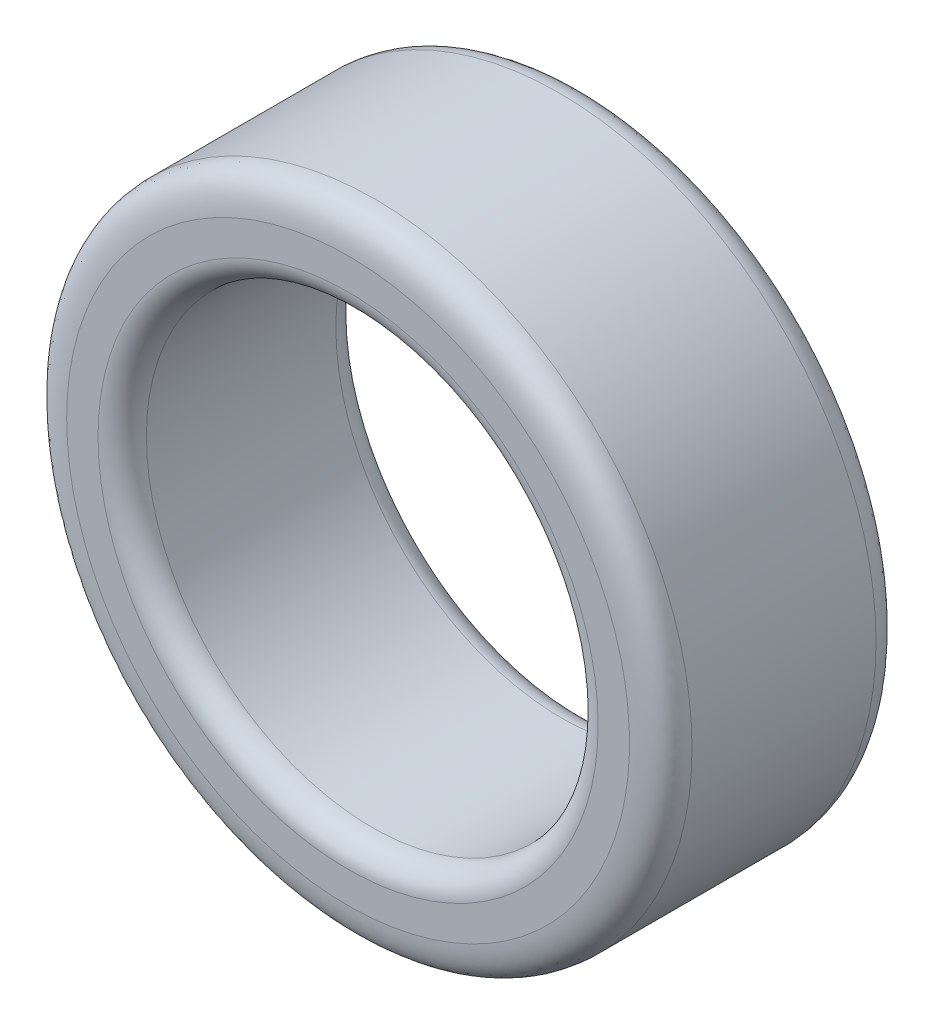
from build123d import *

# Parameters (mm, degrees)
ESQUISSE1_R        = 80
ESQUISSE1_R_2      = 57
BOSS_EXTRU_1_DEPTH = 46.43


with BuildPart() as part:
    # Esquisse1 → Boss.-Extru.1 (new body)
    with BuildSketch(Plane.XY):
        Circle(ESQUISSE1_R)
        Circle(ESQUISSE1_R_2, mode=Mode.SUBTRACT)
    extrude(amount=BOSS_EXTRU_1_DEPTH)

    # Esquisse2 → Révolution1 (revolve)
    with BuildSketch(Plane(origin=(0, 0, 0), x_dir=(0, 0, -1), z_dir=(1, 0, 0)), mode=Mode.PRIVATE) as r_volution1_sk:
        with BuildLine():
            Line((0, 57), (0.689038023, 57))
            ThreePointArc((0.689038023, 57), (5.003069609, 58.786930391), (6.79, 63.100961977))
            Line((6.79, 63.100961977), (6.79, 64))
            Line((6.79, 64), (6.79, 71.015274994))
            add(Edge.make_bspline(
                [(6.79, 71.015274994), (6.446653278, 77.904299494), (4.024026126, 79.849265176), (0, 80)],
                knots=[0, 0, 0, 0, 1, 1, 1, 1], degree=3))
            Line((0, 80), (0, 57))
        make_face()
        with BuildLine():
            Line((-46.43, 57), (-47.119038023, 57))
            ThreePointArc((-47.119038023, 57), (-51.433069609, 58.786930391), (-53.22, 63.100961977))
            Line((-53.22, 63.100961977), (-53.22, 64))
            Line((-53.22, 64), (-53.22, 71.015274994))
            add(Edge.make_bspline(
                [(-53.22, 71.015274994), (-52.876653278, 77.904299494), (-50.454026126, 79.849265176), (-46.43, 80)],
                knots=[0, 0, 0, 0, 1, 1, 1, 1], degree=3))
            Line((-46.43, 80), (-46.43, 57))
        make_face()
    revolve(r_volution1_sk.sketch.rotate(Axis((0, 0, 0), (0, 0, 1)), 90), axis=Axis((0, 0, 0), (0, 0, 1)))


solid = part.part
